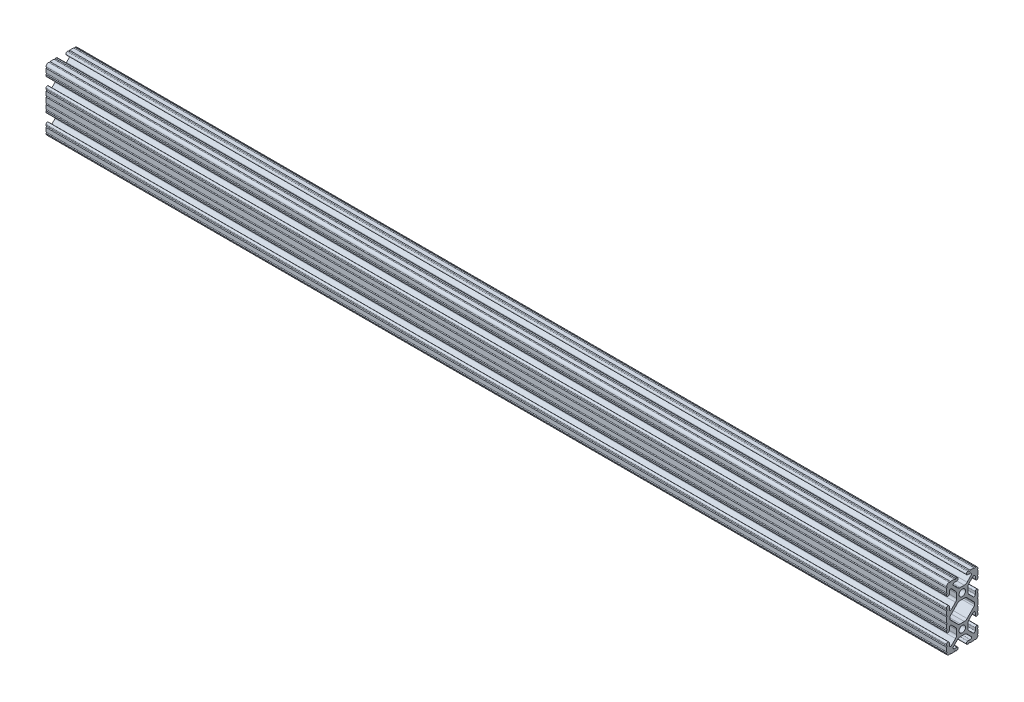
from build123d import *

# Parameters (mm, degrees)
BOSS_EXTRUDE1_DEPTH             = 363.5375
BOSS_EXTRUDE1_DEPTH_BACK        = 363.5375
CUT_EXTRUDE3_DEPTH              = 365.644983383
SKETCH9_R                       = 0.508
CUT_EXTRUDE4_DEPTH              = 365.644983383
CIRPATTERN1_COUNT               = 2
CIRPATTERN1_ANGLE               = 90
CIRPATTERN1_THE_OTHER_WAY_COUNT = 2
CIRPATTERN1_THE_OTHER_WAY_ANGLE = 90
MIRROR1_COPY_1_DEPTH            = 365.644983383
MIRROR1_COPY_2_SKETCH_R         = 0.508
MIRROR1_COPY_2_DEPTH            = 365.644983383
MIRROR1_COPY_3_DEPTH            = 365.644983383
MIRROR1_COPY_4_SKETCH_R         = 0.508
MIRROR1_COPY_4_DEPTH            = 365.644983383
CUT_EXTRUDE1_DEPTH              = 365.644983383
CUT_EXTRUDE1_DEPTH_BACK         = 365.644983383
SKETCH4_R                       = 2.603499997
CUT_EXTRUDE2_DEPTH              = 365.644983383
CUT_EXTRUDE2_DEPTH_BACK         = 365.644983383


with BuildPart() as part:
    # Sketch3 → Boss-Extrude1 (new, two sides: drawn at the far end of the back side and taken through both)
    with BuildSketch(Plane(origin=(0, 0, 0), x_dir=(0, 0, -1), z_dir=(1, 0, 0)).offset(-BOSS_EXTRUDE1_DEPTH_BACK)):
        with BuildLine():
            Line((-10.5918, 25.4), (10.5918, 25.4))
            ThreePointArc((10.5918, 25.4), (12.082522516, 24.782522516), (12.7, 23.2918))
            Line((12.7, 23.2918), (12.7, -23.2918))
            ThreePointArc((12.7, -23.2918), (12.082522516, -24.782522516), (10.5918, -25.4))
            Line((10.5918, -25.4), (-10.5918, -25.4))
            ThreePointArc((-10.5918, -25.4), (-12.082522516, -24.782522516), (-12.7, -23.2918))
            Line((-12.7, -23.2918), (-12.7, 23.2918))
            ThreePointArc((-12.7, 23.2918), (-12.082522516, 24.782522516), (-10.5918, 25.4))
        make_face()
    extrude(amount=BOSS_EXTRUDE1_DEPTH + BOSS_EXTRUDE1_DEPTH_BACK)

    # Sketch8 → Cut-Extrude3 (cut, symmetric)
    with BuildSketch(Plane(origin=(0, 0, 0), x_dir=(0, 0, -1), z_dir=(1, 0, 0))):
        with BuildLine():
            Line((-4.3561, -25.4), (-4.3561, -27.41405794))
            Line((-4.3561, -27.41405794), (4.3561, -27.41405794))
            Line((4.3561, -27.41405794), (4.3561, -25.4))
            ThreePointArc((4.3561, -25.4), (3.2512, -24.2951), (4.3561, -23.1902))
            Line((4.3561, -23.1902), (6.37015794, -23.1902))
            ThreePointArc((6.37015794, -23.1902), (7.348862387, -22.536250595), (7.119225894, -21.381789985))
            Line((7.119225894, -21.381789985), (3.884539021, -18.147103113))
            ThreePointArc((3.884539021, -18.147103113), (2.854494889, -17.458849627), (1.639474991, -17.217167143))
            Line((1.639474991, -17.217167143), (-1.639474991, -17.217167143))
            ThreePointArc((-1.639474991, -17.217167143), (-2.854494889, -17.458849627), (-3.884539021, -18.147103113))
            Line((-3.884539021, -18.147103113), (-7.119225894, -21.381789985))
            ThreePointArc((-7.119225894, -21.381789985), (-7.348862387, -22.536250595), (-6.37015794, -23.1902))
            Line((-6.37015794, -23.1902), (-4.3561, -23.1902))
            ThreePointArc((-4.3561, -23.1902), (-3.2512, -24.2951), (-4.3561, -25.4))
        make_face()
    cut_extrude3 = extrude(amount=CUT_EXTRUDE3_DEPTH, both=True, mode=Mode.SUBTRACT)

    # Sketch9 → Cut-Extrude4 (cut, symmetric)
    with BuildSketch(Plane(origin=(0, 0, 0), x_dir=(0, 0, -1), z_dir=(1, 0, 0))):
        with Locations((-10.0584, -25.4)):
            Circle(SKETCH9_R)
        with Locations((-5.8166, -25.4)):
            Circle(SKETCH9_R)
        with Locations((5.8166, -25.4)):
            Circle(SKETCH9_R)
        with Locations((10.0584, -25.4)):
            Circle(SKETCH9_R)
    cut_extrude4 = extrude(amount=CUT_EXTRUDE4_DEPTH, both=True, mode=Mode.SUBTRACT)

    # CirPattern1: Cut-Extrude3, Cut-Extrude4 ×2 about axis
    cirpattern1_axis = Axis((0, -12.7, 0), (-1, 0, 0))
    add([cut_extrude3.rotate(cirpattern1_axis, i * CIRPATTERN1_ANGLE / (CIRPATTERN1_COUNT - 1)) for i in range(1, CIRPATTERN1_COUNT)], mode=Mode.SUBTRACT)
    add([cut_extrude4.rotate(cirpattern1_axis, i * CIRPATTERN1_ANGLE / (CIRPATTERN1_COUNT - 1)) for i in range(1, CIRPATTERN1_COUNT)], mode=Mode.SUBTRACT)

    # CirPattern1 the other way: Cut-Extrude3, Cut-Extrude4 ×2 about axis
    cirpattern1_the_other_way_axis = Axis((0, -12.7, 0), (1, 0, 0))
    add([cut_extrude3.rotate(cirpattern1_the_other_way_axis, i * CIRPATTERN1_THE_OTHER_WAY_ANGLE / (CIRPATTERN1_THE_OTHER_WAY_COUNT - 1)) for i in range(1, CIRPATTERN1_THE_OTHER_WAY_COUNT)], mode=Mode.SUBTRACT)
    add([cut_extrude4.rotate(cirpattern1_the_other_way_axis, i * CIRPATTERN1_THE_OTHER_WAY_ANGLE / (CIRPATTERN1_THE_OTHER_WAY_COUNT - 1)) for i in range(1, CIRPATTERN1_THE_OTHER_WAY_COUNT)], mode=Mode.SUBTRACT)

    # Mirror1: Cut-Extrude3, Cut-Extrude4 across plane
    add(cut_extrude3.mirror(Plane.ZX), mode=Mode.SUBTRACT)
    add(cut_extrude4.mirror(Plane.ZX), mode=Mode.SUBTRACT)

    # Mirror1 copy 1 sketch → Mirror1 copy 1 (cut, symmetric)
    with BuildSketch(Plane(origin=(0, 12.7, -12.7), x_dir=(0, 1, 0), z_dir=(1, 0, 0))):
        with BuildLine():
            Line((-4.3561, 25.4), (-4.3561, 27.41405794))
            Line((-4.3561, 27.41405794), (4.3561, 27.41405794))
            Line((4.3561, 27.41405794), (4.3561, 25.4))
            ThreePointArc((4.3561, 25.4), (3.2512, 24.2951), (4.3561, 23.1902))
            Line((4.3561, 23.1902), (6.37015794, 23.1902))
            ThreePointArc((6.37015794, 23.1902), (7.348862387, 22.536250595), (7.119225894, 21.381789985))
            Line((7.119225894, 21.381789985), (3.884539021, 18.147103113))
            ThreePointArc((3.884539021, 18.147103113), (2.854494889, 17.458849627), (1.639474991, 17.217167143))
            Line((1.639474991, 17.217167143), (-1.639474991, 17.217167143))
            ThreePointArc((-1.639474991, 17.217167143), (-2.854494889, 17.458849627), (-3.884539021, 18.147103113))
            Line((-3.884539021, 18.147103113), (-7.119225894, 21.381789985))
            ThreePointArc((-7.119225894, 21.381789985), (-7.348862387, 22.536250595), (-6.37015794, 23.1902))
            Line((-6.37015794, 23.1902), (-4.3561, 23.1902))
            ThreePointArc((-4.3561, 23.1902), (-3.2512, 24.2951), (-4.3561, 25.4))
        make_face()
    extrude(amount=MIRROR1_COPY_1_DEPTH, both=True, mode=Mode.SUBTRACT)

    # Mirror1 copy 2 sketch → Mirror1 copy 2 (cut, symmetric)
    with BuildSketch(Plane(origin=(0, 12.7, -12.7), x_dir=(0, 1, 0), z_dir=(1, 0, 0))):
        with Locations((-10.0584, 25.4)):
            Circle(MIRROR1_COPY_2_SKETCH_R)
        with Locations((-5.8166, 25.4)):
            Circle(MIRROR1_COPY_2_SKETCH_R)
        with Locations((5.8166, 25.4)):
            Circle(MIRROR1_COPY_2_SKETCH_R)
        with Locations((10.0584, 25.4)):
            Circle(MIRROR1_COPY_2_SKETCH_R)
    extrude(amount=MIRROR1_COPY_2_DEPTH, both=True, mode=Mode.SUBTRACT)

    # Mirror1 copy 3 sketch → Mirror1 copy 3 (cut, symmetric)
    with BuildSketch(Plane(origin=(0, 12.7, 12.7), x_dir=(0, -1, 0), z_dir=(1, 0, 0))):
        with BuildLine():
            Line((-4.3561, 25.4), (-4.3561, 27.41405794))
            Line((-4.3561, 27.41405794), (4.3561, 27.41405794))
            Line((4.3561, 27.41405794), (4.3561, 25.4))
            ThreePointArc((4.3561, 25.4), (3.2512, 24.2951), (4.3561, 23.1902))
            Line((4.3561, 23.1902), (6.37015794, 23.1902))
            ThreePointArc((6.37015794, 23.1902), (7.348862387, 22.536250595), (7.119225894, 21.381789985))
            Line((7.119225894, 21.381789985), (3.884539021, 18.147103113))
            ThreePointArc((3.884539021, 18.147103113), (2.854494889, 17.458849627), (1.639474991, 17.217167143))
            Line((1.639474991, 17.217167143), (-1.639474991, 17.217167143))
            ThreePointArc((-1.639474991, 17.217167143), (-2.854494889, 17.458849627), (-3.884539021, 18.147103113))
            Line((-3.884539021, 18.147103113), (-7.119225894, 21.381789985))
            ThreePointArc((-7.119225894, 21.381789985), (-7.348862387, 22.536250595), (-6.37015794, 23.1902))
            Line((-6.37015794, 23.1902), (-4.3561, 23.1902))
            ThreePointArc((-4.3561, 23.1902), (-3.2512, 24.2951), (-4.3561, 25.4))
        make_face()
    extrude(amount=MIRROR1_COPY_3_DEPTH, both=True, mode=Mode.SUBTRACT)

    # Mirror1 copy 4 sketch → Mirror1 copy 4 (cut, symmetric)
    with BuildSketch(Plane(origin=(0, 12.7, 12.7), x_dir=(0, -1, 0), z_dir=(1, 0, 0))):
        with Locations((-10.0584, 25.4)):
            Circle(MIRROR1_COPY_4_SKETCH_R)
        with Locations((-5.8166, 25.4)):
            Circle(MIRROR1_COPY_4_SKETCH_R)
        with Locations((5.8166, 25.4)):
            Circle(MIRROR1_COPY_4_SKETCH_R)
        with Locations((10.0584, 25.4)):
            Circle(MIRROR1_COPY_4_SKETCH_R)
    extrude(amount=MIRROR1_COPY_4_DEPTH, both=True, mode=Mode.SUBTRACT)

    # Sketch4 → Cut-Extrude1 (cut, two sides: drawn at the far end of the back side and taken through both)
    with BuildSketch(Plane(origin=(0, 0, 0), x_dir=(0, 0, -1), z_dir=(1, 0, 0)).offset(-CUT_EXTRUDE1_DEPTH_BACK)):
        with Locations((0, 12.7)):
            Circle(SKETCH4_R)
        with Locations((0, -12.7)):
            Circle(SKETCH4_R)
    extrude(amount=CUT_EXTRUDE1_DEPTH + CUT_EXTRUDE1_DEPTH_BACK, mode=Mode.SUBTRACT)

    # Sketch5 → Cut-Extrude2 (cut, two sides: drawn at the far end of the back side and taken through both)
    with BuildSketch(Plane(origin=(0, 0, 0), x_dir=(0, 0, -1), z_dir=(1, 0, 0)).offset(-CUT_EXTRUDE2_DEPTH_BACK)):
        with BuildLine():
            Line((-9.571751759, 1.56568415), (-3.884539021, 7.252896887))
            ThreePointArc((-3.884539021, 7.252896887), (-2.854494889, 7.941150373), (-1.639474991, 8.182832857))
            Line((-1.639474991, 8.182832857), (1.639474991, 8.182832857))
            ThreePointArc((1.639474991, 8.182832857), (2.854494889, 7.941150373), (3.884539021, 7.252896887))
            Line((3.884539021, 7.252896887), (9.571751759, 1.56568415))
            ThreePointArc((9.571751759, 1.56568415), (9.913125488, 1.05478226), (10.033, 0.452132391))
            Line((10.033, 0.452132391), (10.033, -0.452132391))
            ThreePointArc((10.033, -0.452132391), (9.913125488, -1.05478226), (9.571751759, -1.56568415))
            Line((9.571751759, -1.56568415), (3.884539021, -7.252896887))
            ThreePointArc((3.884539021, -7.252896887), (2.854494889, -7.941150373), (1.639474991, -8.182832857))
            Line((1.639474991, -8.182832857), (-1.639474991, -8.182832857))
            ThreePointArc((-1.639474991, -8.182832857), (-2.854494889, -7.941150373), (-3.884539021, -7.252896887))
            Line((-3.884539021, -7.252896887), (-9.571751759, -1.56568415))
            ThreePointArc((-9.571751759, -1.56568415), (-9.913125488, -1.05478226), (-10.033, -0.452132391))
            Line((-10.033, -0.452132391), (-10.033, 0.452132391))
            ThreePointArc((-10.033, 0.452132391), (-9.913125488, 1.05478226), (-9.571751759, 1.56568415))
        make_face()
    extrude(amount=CUT_EXTRUDE2_DEPTH + CUT_EXTRUDE2_DEPTH_BACK, mode=Mode.SUBTRACT)


solid = part.part
